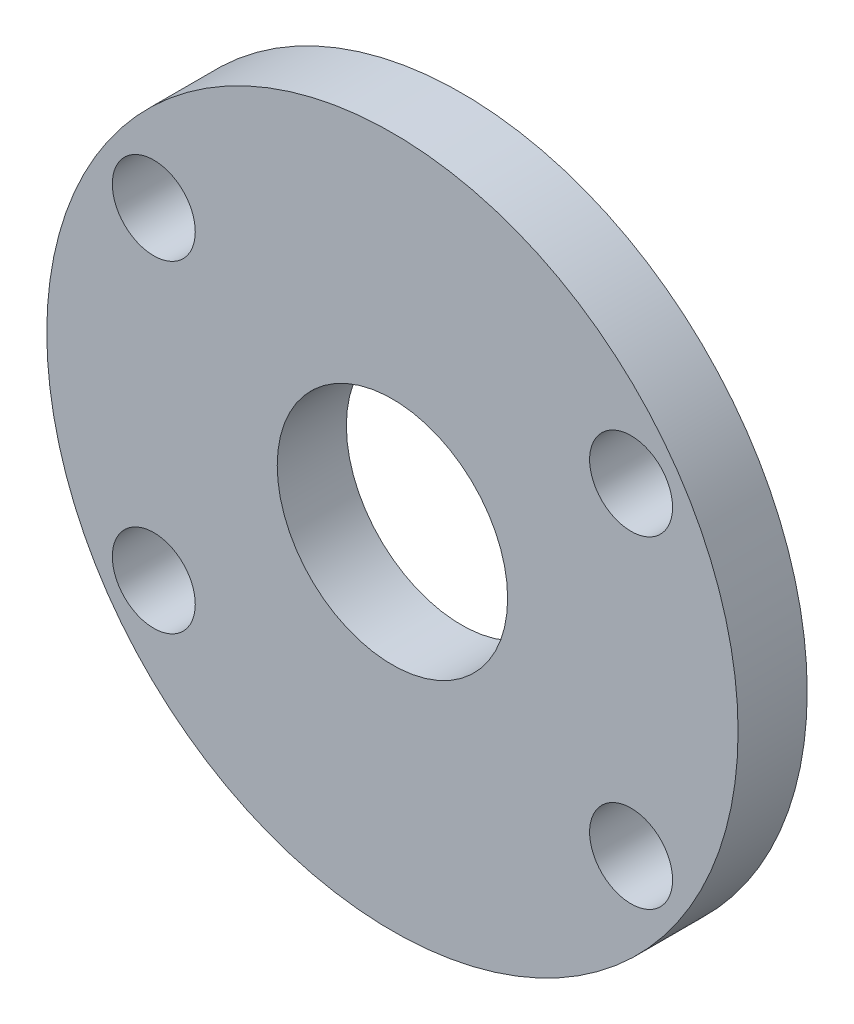
from build123d import *

# Parameters (mm, degrees)
SKETCH_1_R          = 15
EXTRUDE_1_DEPTH     = 3
CUT_EXTRUDE_1_REACH = 23.424
SKETCH_2_R          = 5
CUT_EXTRUDE_2_REACH = 23.424
SKETCH_3_R          = 1.8


with BuildPart() as part:
    # 草图1 → 凸台-拉伸1 (new body)
    with BuildSketch(Plane.XY):
        Circle(SKETCH_1_R)
    extrude(amount=EXTRUDE_1_DEPTH)

    # 草图2 → 切除-拉伸1 (cut, up to next)
    with BuildSketch(Plane.XY.offset(3), mode=Mode.PRIVATE) as cut_extrude_1_sk1:
        Circle(SKETCH_2_R)
    cut_extrude_1_tool1 = extrude(cut_extrude_1_sk1.sketch, amount=-CUT_EXTRUDE_1_REACH, mode=Mode.PRIVATE) & part.part
    add(cut_extrude_1_tool1.solids().sort_by_distance((0, 0, 3))[0], mode=Mode.SUBTRACT)

    # 草图3 → 切除-拉伸2 (cut, up to next)
    with BuildSketch(Plane.XY.offset(3), mode=Mode.PRIVATE) as cut_extrude_2_sk1:
        with Locations((-10.356157589, -7)):
            Circle(SKETCH_3_R)
    cut_extrude_2_tool1 = extrude(cut_extrude_2_sk1.sketch, amount=-CUT_EXTRUDE_2_REACH, mode=Mode.PRIVATE) & part.part
    # 草图3 → 切除-拉伸2 (cut, up to next)
    with BuildSketch(Plane.XY.offset(3), mode=Mode.PRIVATE) as cut_extrude_2_sk2:
        with Locations((10.356157589, -7)):
            Circle(SKETCH_3_R)
    cut_extrude_2_tool2 = extrude(cut_extrude_2_sk2.sketch, amount=-CUT_EXTRUDE_2_REACH, mode=Mode.PRIVATE) & part.part
    # 草图3 → 切除-拉伸2 (cut, up to next)
    with BuildSketch(Plane.XY.offset(3), mode=Mode.PRIVATE) as cut_extrude_2_sk3:
        with Locations((10.356157589, 7)):
            Circle(SKETCH_3_R)
    cut_extrude_2_tool3 = extrude(cut_extrude_2_sk3.sketch, amount=-CUT_EXTRUDE_2_REACH, mode=Mode.PRIVATE) & part.part
    # 草图3 → 切除-拉伸2 (cut, up to next)
    with BuildSketch(Plane.XY.offset(3), mode=Mode.PRIVATE) as cut_extrude_2_sk4:
        with Locations((-10.356157589, 7)):
            Circle(SKETCH_3_R)
    cut_extrude_2_tool4 = extrude(cut_extrude_2_sk4.sketch, amount=-CUT_EXTRUDE_2_REACH, mode=Mode.PRIVATE) & part.part
    add(cut_extrude_2_tool1.solids().sort_by_distance((-10.356158, -7, 3))[0], mode=Mode.SUBTRACT)
    add(cut_extrude_2_tool2.solids().sort_by_distance((10.356158, -7, 3))[0], mode=Mode.SUBTRACT)
    add(cut_extrude_2_tool3.solids().sort_by_distance((10.356158, 7, 3))[0], mode=Mode.SUBTRACT)
    add(cut_extrude_2_tool4.solids().sort_by_distance((-10.356158, 7, 3))[0], mode=Mode.SUBTRACT)


solid = part.part
